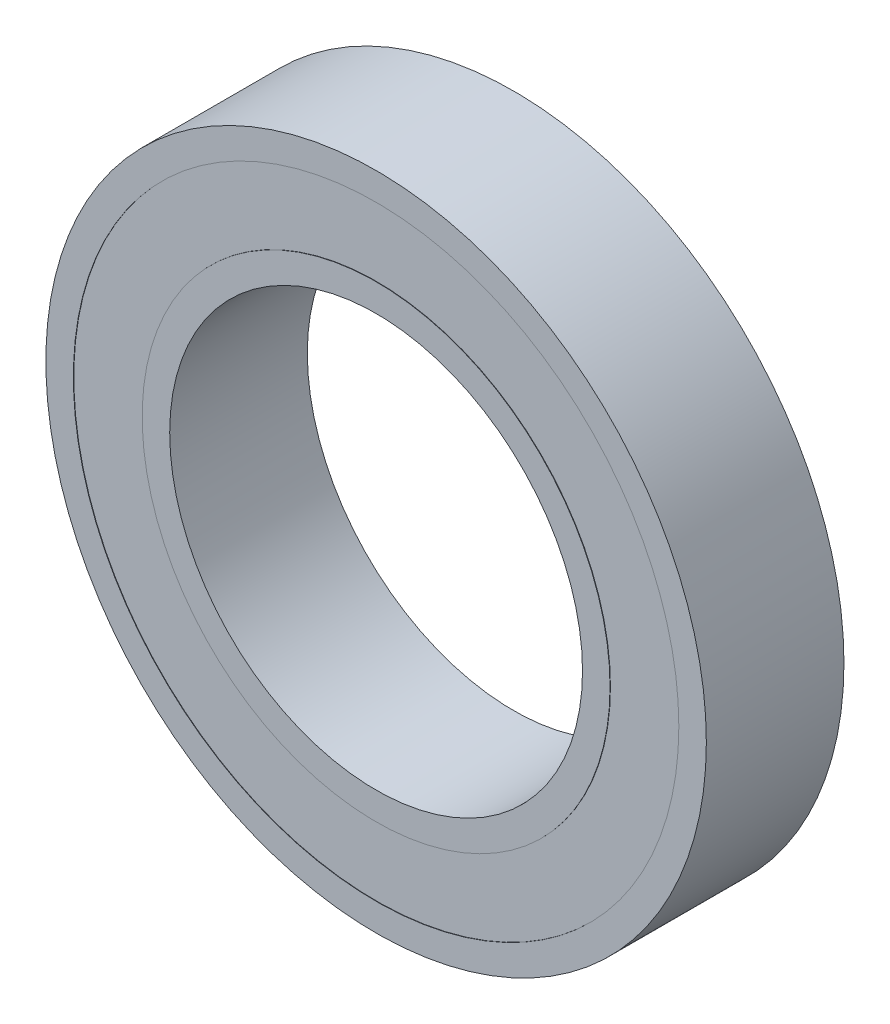
from build123d import *

# Parameters (mm, degrees)
BOSS_EXTRUDE1_DEPTH        = 2.5
BOSS_EXTRUDE1_DEPTH_BACK   = 2.5
SKETCH1_R                  = 8.5
SKETCH1_R_2                = 7.5
BOSS_EXTRUDE1_2_DEPTH      = 2.5
BOSS_EXTRUDE1_2_DEPTH_BACK = 2.5
SKETCH1_R_3                = 12
SKETCH1_R_4                = 11
BOSS_EXTRUDE2_DEPTH        = 2.484375
BOSS_EXTRUDE2_DEPTH_BACK   = 2.484375
SKETCH1_3_R                = 11
SKETCH1_3_R_2              = 8.5


with BuildPart() as part:
    # Sketch1 → Boss-Extrude1 (new, two sides: drawn at the far end of the back side and taken through both)
    with BuildSketch(Plane.XY.offset(-BOSS_EXTRUDE1_DEPTH_BACK)):
        Circle(SKETCH1_R)
        Circle(SKETCH1_R_2, mode=Mode.SUBTRACT)
    extrude(amount=BOSS_EXTRUDE1_DEPTH + BOSS_EXTRUDE1_DEPTH_BACK)



with BuildPart() as body_2:
    # Sketch1 → Boss-Extrude1 2 (new, two sides: drawn at the far end of the back side and taken through both)
    with BuildSketch(Plane.XY.offset(-BOSS_EXTRUDE1_2_DEPTH_BACK)):
        Circle(SKETCH1_R_3)
        Circle(SKETCH1_R_4, mode=Mode.SUBTRACT)
    extrude(amount=BOSS_EXTRUDE1_2_DEPTH + BOSS_EXTRUDE1_2_DEPTH_BACK)


with BuildPart() as part_1:
    add(part.part)

    add(body_2.part)  # Boss-Extrude2 merges body 2
    # Sketch1<3> → Boss-Extrude2 (add, two sides: drawn at the far end of the back side and taken through both)
    with BuildSketch(Plane.XY.offset(-BOSS_EXTRUDE2_DEPTH_BACK)):
        Circle(SKETCH1_3_R)
        Circle(SKETCH1_3_R_2, mode=Mode.SUBTRACT)
    extrude(amount=BOSS_EXTRUDE2_DEPTH + BOSS_EXTRUDE2_DEPTH_BACK)


solid = part_1.part
